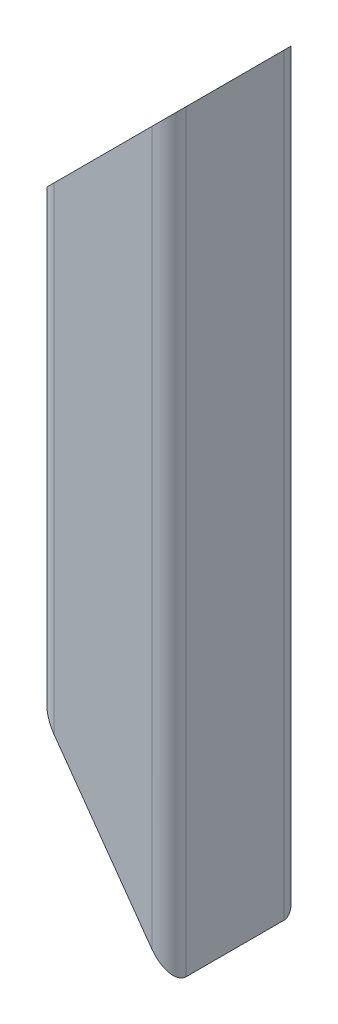
from build123d import *

# Parameters (mm, degrees)
BOSS_EXTRUDE1_DEPTH = 144.78
CUT_EXTRUDE1_DEPTH  = 148.538803032


with BuildPart() as part:
    # Sketch1 → Boss-Extrude1 (new body)
    with BuildSketch(Plane(origin=(0, 0, 0), x_dir=(1, 0, 0), z_dir=(0, 1, 0))):
        with BuildLine():
            Line((-9.398, 0), (9.398, 0))
            ThreePointArc((9.398, 0), (11.732866591, 0.967133409), (12.7, 3.302))
            Line((12.7, 3.302), (12.7, 22.098))
            ThreePointArc((12.7, 22.098), (11.732866591, 24.432866591), (9.398, 25.4))
            Line((9.398, 25.4), (-9.398, 25.4))
            ThreePointArc((-9.398, 25.4), (-11.732866591, 24.432866591), (-12.7, 22.098))
            Line((-12.7, 22.098), (-12.7, 3.302))
            ThreePointArc((-12.7, 3.302), (-11.732866591, 0.967133409), (-9.398, 0))
        make_face()
        with BuildLine():
            Line((-6.477, 3.175), (6.477, 3.175))
            ThreePointArc((6.477, 3.175), (8.632261469, 4.067738531), (9.525, 6.223))
            Line((9.525, 6.223), (9.525, 19.177))
            ThreePointArc((9.525, 19.177), (8.632261469, 21.332261469), (6.477, 22.225))
            Line((6.477, 22.225), (-6.477, 22.225))
            ThreePointArc((-6.477, 22.225), (-8.632261469, 21.332261469), (-9.525, 19.177))
            Line((-9.525, 19.177), (-9.525, 6.223))
            ThreePointArc((-9.525, 6.223), (-8.632261469, 4.067738531), (-6.477, 3.175))
        make_face(mode=Mode.SUBTRACT)
    extrude(amount=BOSS_EXTRUDE1_DEPTH)

    # Sketch2 → Cut-Extrude1 (cut, through all)
    with BuildSketch(Plane.XY):
        Polygon((12.7, 144.78), (-12.7, 119.38), (-12.7, 144.78), align=None)
        Polygon((12.7, 0), (-12.7, 35.56), (-12.7, 0), align=None)
    extrude(amount=-CUT_EXTRUDE1_DEPTH, mode=Mode.SUBTRACT)


solid = part.part
